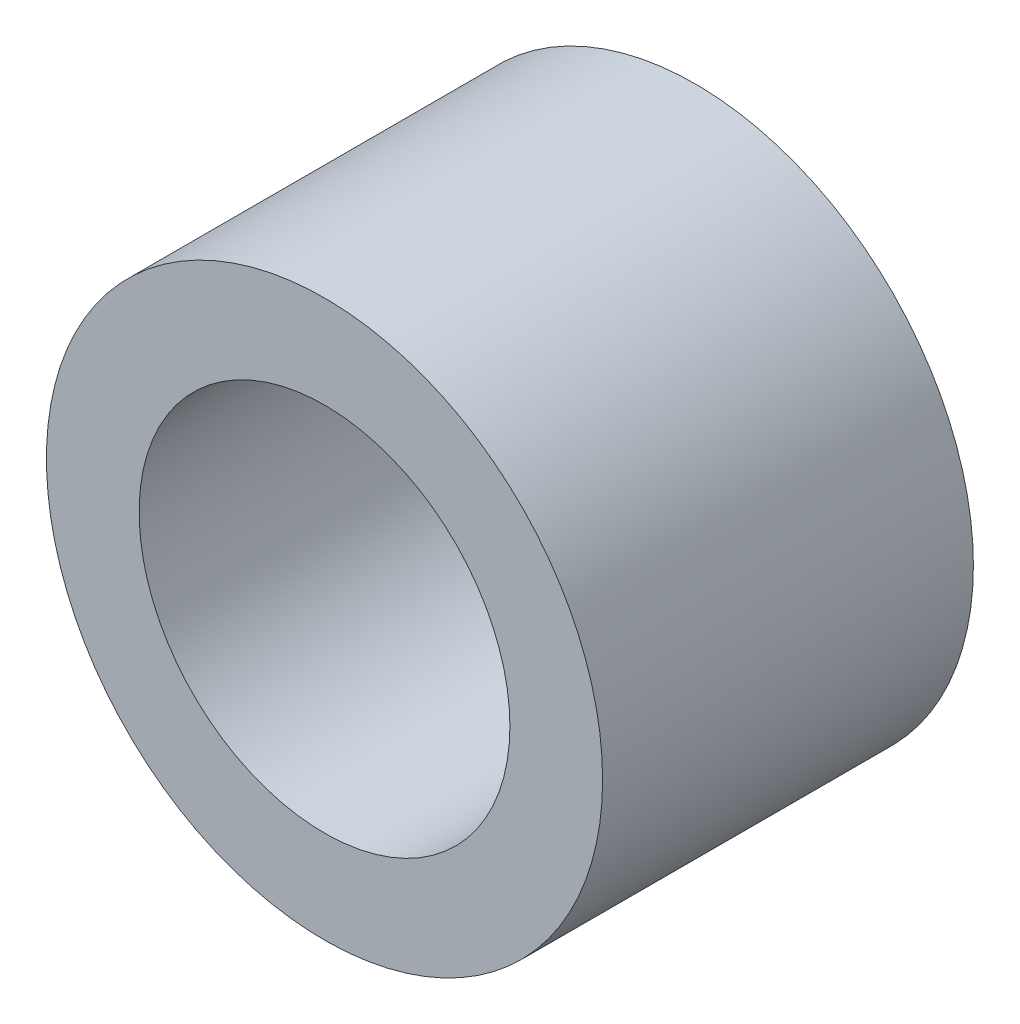
from build123d import *

# Parameters (mm, degrees)
SKETCH_1_R      = 4.5
SKETCH_1_R_2    = 3
EXTRUDE_1_DEPTH = 6


with BuildPart() as part:
    # 草图1 → 凸台-拉伸1 (new body)
    with BuildSketch(Plane.XY):
        Circle(SKETCH_1_R)
        Circle(SKETCH_1_R_2, mode=Mode.SUBTRACT)
    extrude(amount=EXTRUDE_1_DEPTH)


solid = part.part
